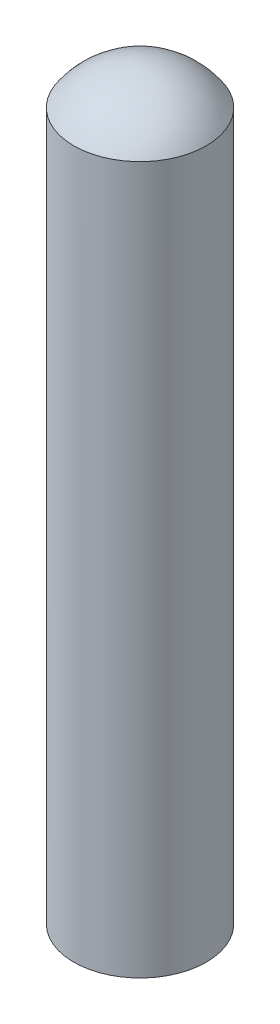
from build123d import *


with BuildPart() as part:
    # Sketch1 → Revolve1 (revolve)
    with BuildSketch(Plane.XY):
        with BuildLine():
            Line((0, 0), (2.9765625, 0))
            Line((2.9765625, 0), (2.9765625, 33.338377373))
            ThreePointArc((2.9765625, 33.338377373), (1.289637265, 32.916440424), (0, 31.75))
            Line((0, 31.75), (0, 0))
        make_face()
    revolve(axis=Axis((2.9765625, 0, 0), (0, 1, 0)))


solid = part.part
